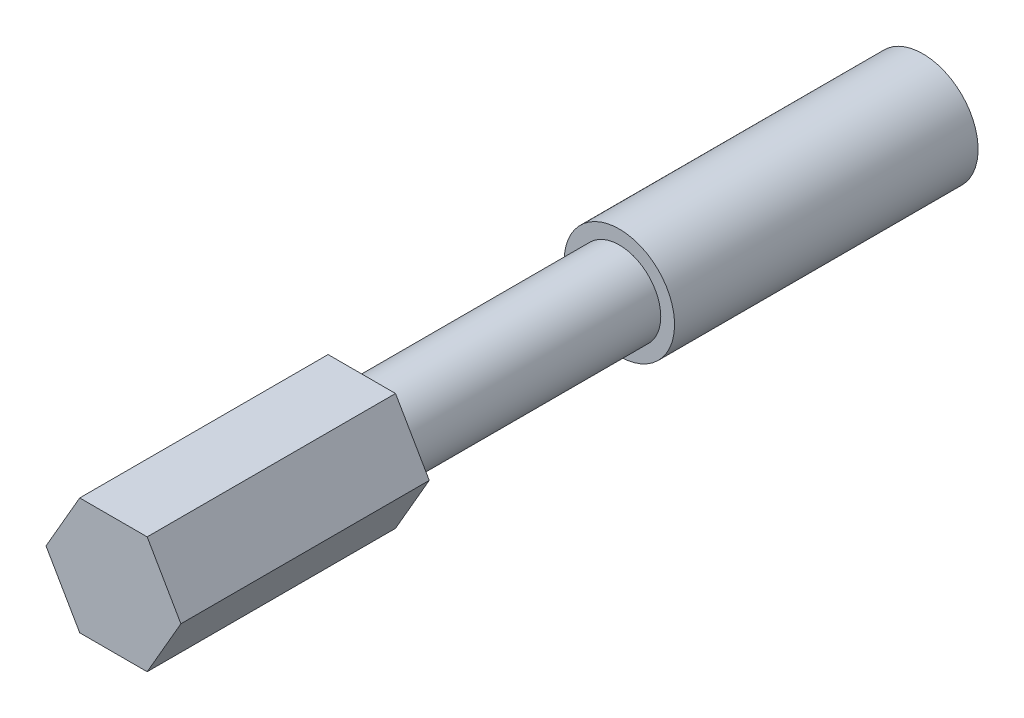
from build123d import *

# Parameters (mm, degrees)
BOSS_EXTRUDE1_DEPTH = 27
SKETCH2_R           = 4.5
BOSS_EXTRUDE2_DEPTH = 61
CUT_EXTRUDE1_DEPTH  = 14
SKETCH4_R           = 6
BOSS_EXTRUDE3_DEPTH = 33


with BuildPart() as part:
    # Sketch1 → Boss-Extrude1 (new body)
    with BuildSketch(Plane.XY):
        Polygon((3.666174209, -6.35), (7.332348419, 0), (3.666174209, 6.35), (-3.666174209, 6.35), (-7.332348419, 0), (-3.666174209, -6.35), align=None)
    extrude(amount=BOSS_EXTRUDE1_DEPTH)

    # Sketch2 → Boss-Extrude2 (add)
    with BuildSketch(Plane(origin=(0, 0, 0), x_dir=(-1, 0, 0), z_dir=(0, 0, -1))):
        with Locations(Location((0, 0, 0), (0, 0, 180))):
            Circle(SKETCH2_R)
    extrude(amount=BOSS_EXTRUDE2_DEPTH)

    # Sketch3 → Cut-Extrude1 (cut)
    with BuildSketch(Plane(origin=(0, 0, -61), x_dir=(-1, 0, 0), z_dir=(0, 0, -1))):
        with BuildLine():
            Line((-2.645751311, 3), (2.645751311, 3))
            ThreePointArc((2.645751311, 3), (4, 0), (2.645751311, -3))
            Line((2.645751311, -3), (-2.645751311, -3))
            ThreePointArc((-2.645751311, -3), (-4, 0), (-2.645751311, 3))
        make_face()
    extrude(amount=-CUT_EXTRUDE1_DEPTH, mode=Mode.SUBTRACT)

    # Sketch4 → Boss-Extrude3 (add)
    with BuildSketch(Plane(origin=(0, 0, -61), x_dir=(-1, 0, 0), z_dir=(0, 0, -1))):
        Circle(SKETCH4_R)
        with BuildLine():
            Line((-2.645751311, -3), (2.645751311, -3))
            ThreePointArc((2.645751311, -3), (4, 0), (2.645751311, 3))
            Line((2.645751311, 3), (-2.645751311, 3))
            ThreePointArc((-2.645751311, 3), (-4, 0), (-2.645751311, -3))
        make_face(mode=Mode.SUBTRACT)
    extrude(amount=-BOSS_EXTRUDE3_DEPTH)


solid = part.part
